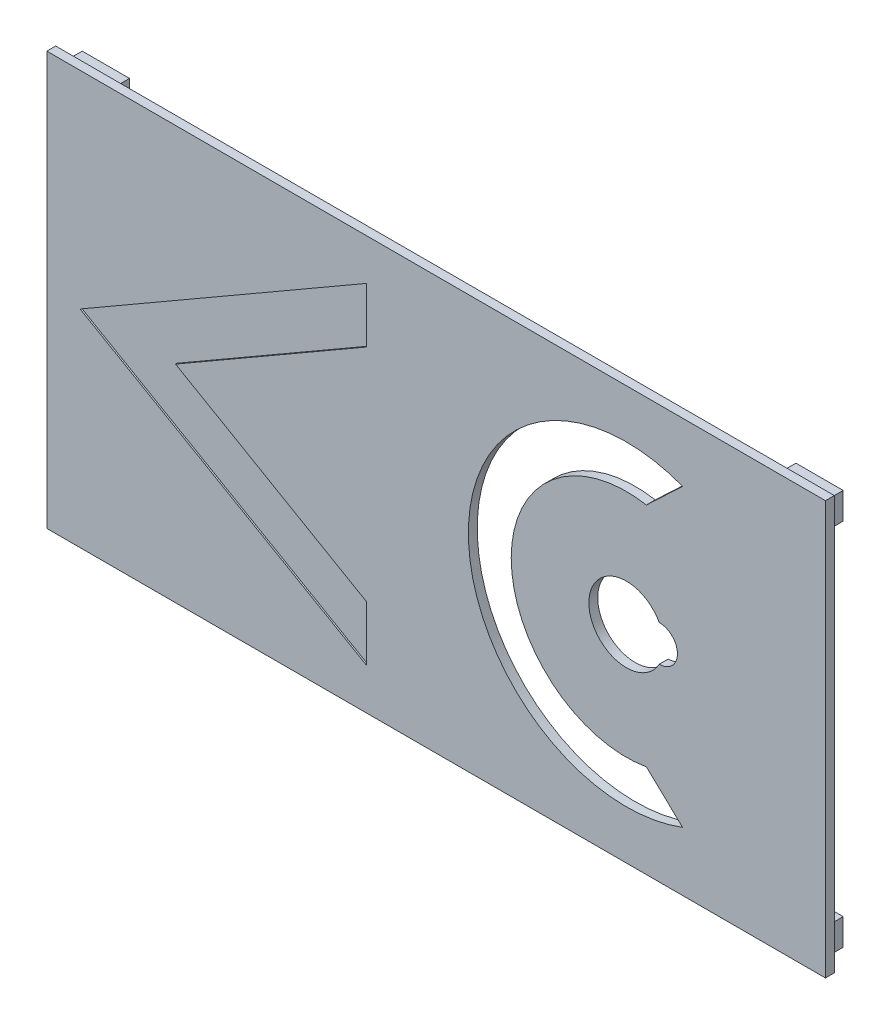
from build123d import *

# Parameters (mm, degrees)
SKETCH1_W                 = 131.85
SKETCH1_H                 = 70
BOSS_EXTRUDE1_DEPTH       = 1.5
CUT_EXTRUDE1_REACH        = 137.268
SKETCH4_W                 = 8
SKETCH4_H                 = 4.5
SKETCH4_W_2               = 5
SKETCH4_H_2               = 1.5
BOSS_EXTRUDE2_DEPTH       = 3
MIRROR2_COPY_1_SKETCH_W   = 8
MIRROR2_COPY_1_SKETCH_H   = 4.5
MIRROR2_COPY_1_SKETCH_W_2 = 5
MIRROR2_COPY_1_SKETCH_H_2 = 1.5
MIRROR2_COPY_1_DEPTH      = 3
CUT_EXTRUDE2_REACH        = 137.335
CUT_EXTRUDE3_DEPTH        = 0.25


with BuildPart() as part:
    # Sketch1 → Boss-Extrude1 (new body)
    with BuildSketch(Plane.XY):
        with Locations((55.175, 25.25)):
            Rectangle(SKETCH1_W, SKETCH1_H)
    extrude(amount=BOSS_EXTRUDE1_DEPTH)

    # Sketch2 → Cut-Extrude1 (cut, up to next)
    with BuildSketch(Plane.XY.offset(1.5), mode=Mode.PRIVATE) as cut_extrude1_sk1:
        with BuildLine():
            Line((92.957060126, 22.2), (92.9875, 22.2))
            ThreePointArc((92.9875, 22.2), (96.0375, 25.25), (92.9875, 28.3))
            Line((92.9875, 28.3), (92.957060126, 28.3))
            ThreePointArc((92.957060126, 28.3), (81.0375, 25.25), (92.957060126, 22.2))
        make_face()
    cut_extrude1_tool1 = extrude(cut_extrude1_sk1.sketch, amount=-CUT_EXTRUDE1_REACH, mode=Mode.PRIVATE) & part.part
    add(cut_extrude1_tool1.solids().sort_by_distance((87.98685, 25.25, 1.5))[0], mode=Mode.SUBTRACT)

    # Sketch4 → Boss-Extrude2 (add)
    with BuildSketch(Plane(origin=(0, 0, 0), x_dir=(-1, 0, 0), z_dir=(0, 0, -1))):
        with Locations((-115.6, 56.5)):
            Rectangle(SKETCH4_W, SKETCH4_H)
        with Locations((-115.6, 56.5)):
            Rectangle(SKETCH4_W_2, SKETCH4_H_2, mode=Mode.SUBTRACT)
    boss_extrude2 = extrude(amount=BOSS_EXTRUDE2_DEPTH)

    # Mirror1: Boss-Extrude2 across plane
    add(boss_extrude2.mirror(Plane.ZX.offset(25.25)))

    # Mirror2: Boss-Extrude2 across plane
    add(boss_extrude2.mirror(Plane(origin=(55.175, 0, 0), x_dir=(0, 0, 1), z_dir=(1, 0, 0))))

    # Mirror2 copy 1 sketch → Mirror2 copy 1 (add)
    with BuildSketch(Plane(origin=(110.35, 50.5, 0), x_dir=(1, 0, 0), z_dir=(0, 0, -1))):
        with Locations((-115.6, 56.5)):
            Rectangle(MIRROR2_COPY_1_SKETCH_W, MIRROR2_COPY_1_SKETCH_H)
        with Locations((-115.6, 56.5)):
            Rectangle(MIRROR2_COPY_1_SKETCH_W_2, MIRROR2_COPY_1_SKETCH_H_2, mode=Mode.SUBTRACT)
    extrude(amount=MIRROR2_COPY_1_DEPTH)

    # Sketch5 → Cut-Extrude2 (cut, up to next)
    with BuildSketch(Plane.XY.offset(1.5), mode=Mode.PRIVATE) as cut_extrude2_sk1:
        with BuildLine():
            Line((90.774215328, 6.046350365), (96.908092333, 0.244034279))
            ThreePointArc((96.908092333, 0.244034279), (60.630444856, 25.25), (96.908092333, 50.255965721))
            Line((96.908092333, 50.255965721), (90.774215328, 44.453649635))
            ThreePointArc((90.774215328, 44.453649635), (67.8875, 25.25), (90.774215328, 6.046350365))
        make_face()
    cut_extrude2_tool1 = extrude(cut_extrude2_sk1.sketch, amount=-CUT_EXTRUDE2_REACH, mode=Mode.PRIVATE) & part.part
    add(cut_extrude2_tool1.solids().sort_by_distance((67.240984, 25.25, 1.5))[0], mode=Mode.SUBTRACT)

    # Sketch6 → Cut-Extrude3 (cut)
    with BuildSketch(Plane.XY.offset(1.5)):
        Polygon((-5.119922612, 25.25), (43.3775, -2.75), (43.3775, 6.583333333), (11.045884925, 25.25), (43.3775, 43.916666667), (43.3775, 53.25), align=None)
    extrude(amount=-CUT_EXTRUDE3_DEPTH, mode=Mode.SUBTRACT)


solid = part.part
